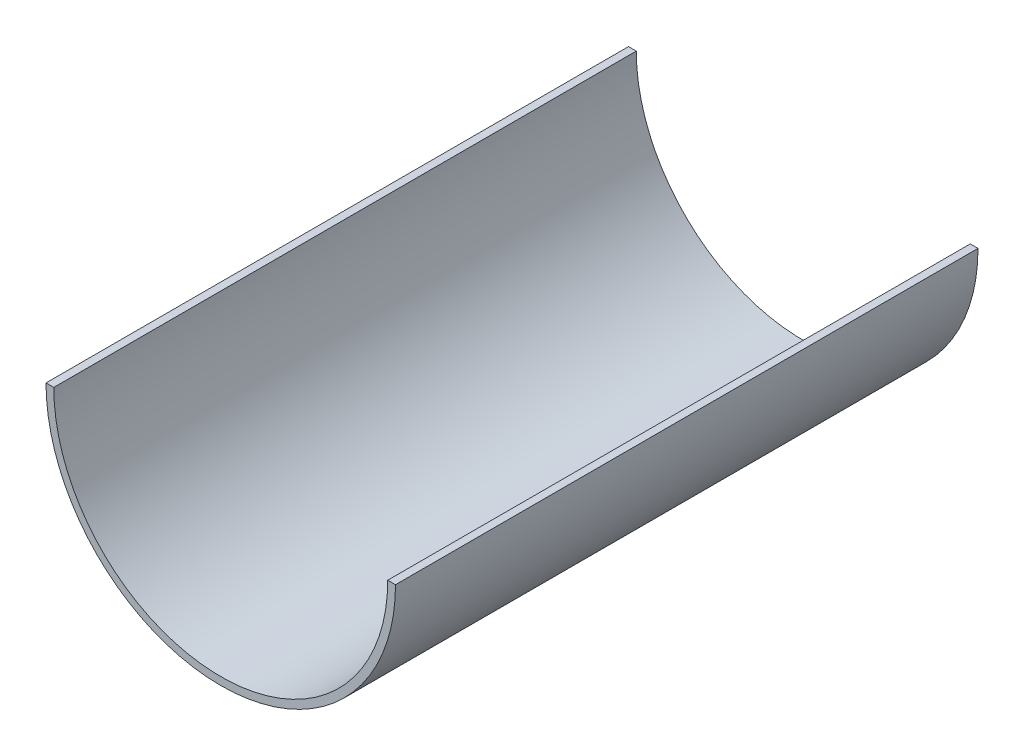
from build123d import *

# Parameters (mm, degrees)
BOSS_EXTRUDE1_DEPTH = 150


with BuildPart() as part:
    # Sketch1 → Boss-Extrude1 (new body)
    with BuildSketch(Plane.XY):
        with BuildLine():
            Line((-45, 0), (-43, 0))
            ThreePointArc((-43, 0), (0, -43), (43, 0))
            Line((43, 0), (45, 0))
            ThreePointArc((45, 0), (0, -45), (-45, 0))
        make_face()
    extrude(amount=BOSS_EXTRUDE1_DEPTH)


solid = part.part
